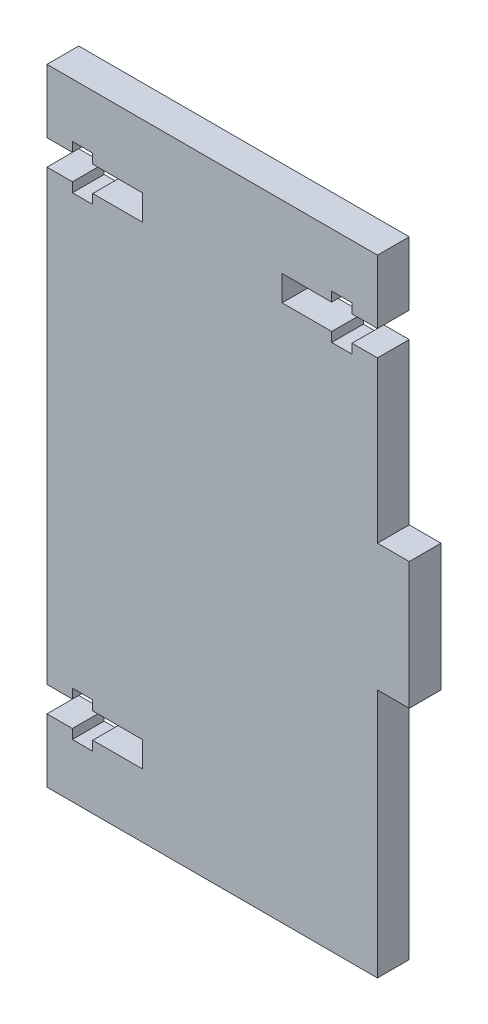
from build123d import *

# Parameters (mm, degrees)
BOSS_EXTRUDE1_DEPTH = 5
CUT_EXTRUDE1_DEPTH  = 10


with BuildPart() as part:
    # Sketch1 → Boss-Extrude1 (new body)
    with BuildSketch(Plane.XY):
        Polygon((26, 10), (31, 10), (31, -10), (26, -10), (26, -49.25), (-26, -49.25), (-26, 49.25), (26, 49.25), align=None)
    extrude(amount=BOSS_EXTRUDE1_DEPTH)

    # Sketch2 → Cut-Extrude1 (cut)
    with BuildSketch(Plane(origin=(0, 0, 0), x_dir=(-1, 0, 0), z_dir=(0, 0, -1))):
        Polygon((26, 39.25), (22, 39.25), (22, 40.75), (18.8, 40.75), (18.8, 39.25), (11, 39.25), (11, 35.25), (18.8, 35.25), (18.8, 33.75), (22, 33.75), (22, 35.25), (26, 35.25), align=None)
        Polygon((26, -35.25), (26, -39.25), (22, -39.25), (22, -40.75), (18.8, -40.75), (18.8, -39.25), (11, -39.25), (11, -35.25), (18.8, -35.25), (18.8, -33.75), (22, -33.75), (22, -35.25), align=None)
        Polygon((-26, 35.25), (-26, 39.25), (-22, 39.25), (-22, 40.75), (-18.8, 40.75), (-18.8, 39.25), (-11, 39.25), (-11, 35.25), (-18.8, 35.25), (-18.8, 33.75), (-22, 33.75), (-22, 35.25), align=None)
    extrude(amount=-CUT_EXTRUDE1_DEPTH, mode=Mode.SUBTRACT)


solid = part.part
